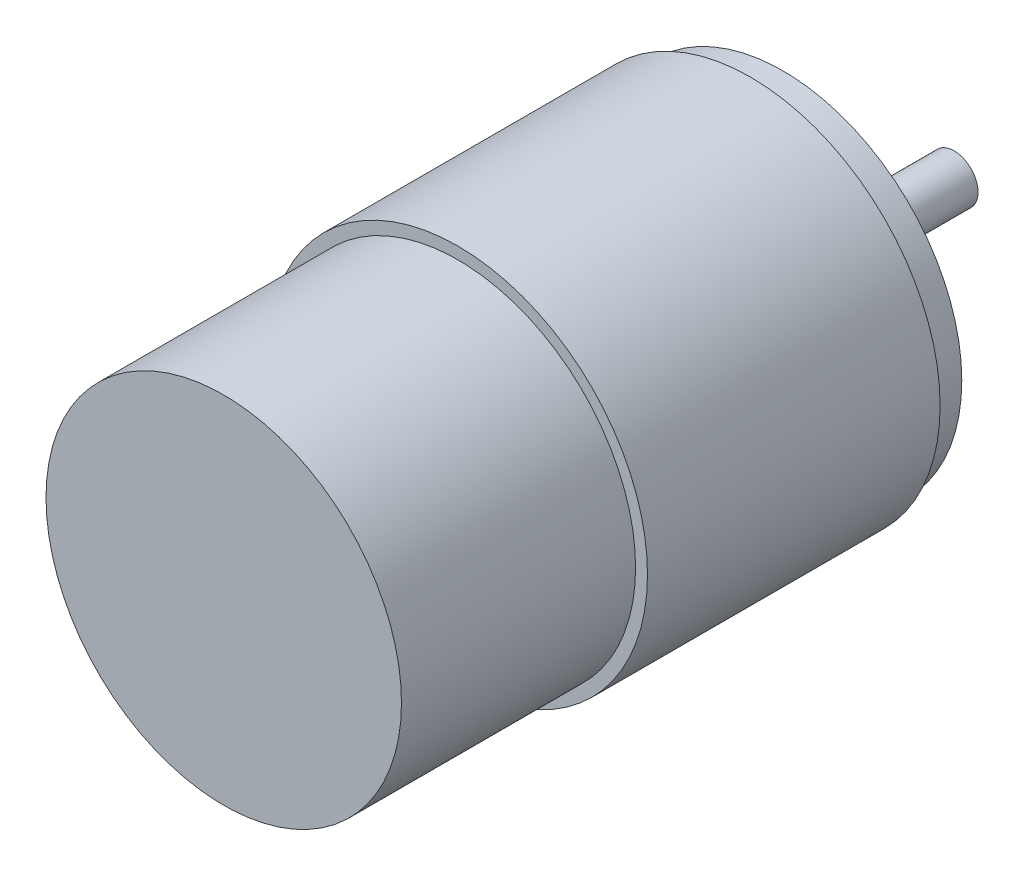
from build123d import *

# Parameters (mm, degrees)
SKETCH3_R           = 20.955
BOSS_EXTRUDE3_DEPTH = 3.81
SKETCH4_R           = 22.225
BOSS_EXTRUDE4_DEPTH = 34.29
SKETCH5_R           = 20.828
BOSS_EXTRUDE5_DEPTH = 27.432
SKETCH6_R           = 8.636
BOSS_EXTRUDE6_DEPTH = 4.064
SKETCH7_R           = 2.794
BOSS_EXTRUDE7_DEPTH = 16.002


with BuildPart() as part:
    # Sketch3 → Boss-Extrude3 (new body)
    with BuildSketch(Plane.XY):
        with Locations(Location((0, 0, 0), (0, 0, 180))):
            Circle(SKETCH3_R)
    extrude(amount=BOSS_EXTRUDE3_DEPTH)

    # Sketch4 → Boss-Extrude4 (add)
    with BuildSketch(Plane.XY.offset(3.81)):
        Circle(SKETCH4_R)
    extrude(amount=BOSS_EXTRUDE4_DEPTH)

    # Sketch5 → Boss-Extrude5 (add)
    with BuildSketch(Plane.XY.offset(38.1)):
        Circle(SKETCH5_R)
    extrude(amount=BOSS_EXTRUDE5_DEPTH)

    # Sketch6 → Boss-Extrude6 (add)
    with BuildSketch(Plane(origin=(0, 0, 0), x_dir=(-1, 0, 0), z_dir=(0, 0, -1))):
        Circle(SKETCH6_R)
    extrude(amount=BOSS_EXTRUDE6_DEPTH)

    # Sketch7 → Boss-Extrude7 (add)
    with BuildSketch(Plane(origin=(0, 0, -4.064), x_dir=(-1, 0, 0), z_dir=(0, 0, -1))):
        Circle(SKETCH7_R)
    extrude(amount=BOSS_EXTRUDE7_DEPTH)


solid = part.part
